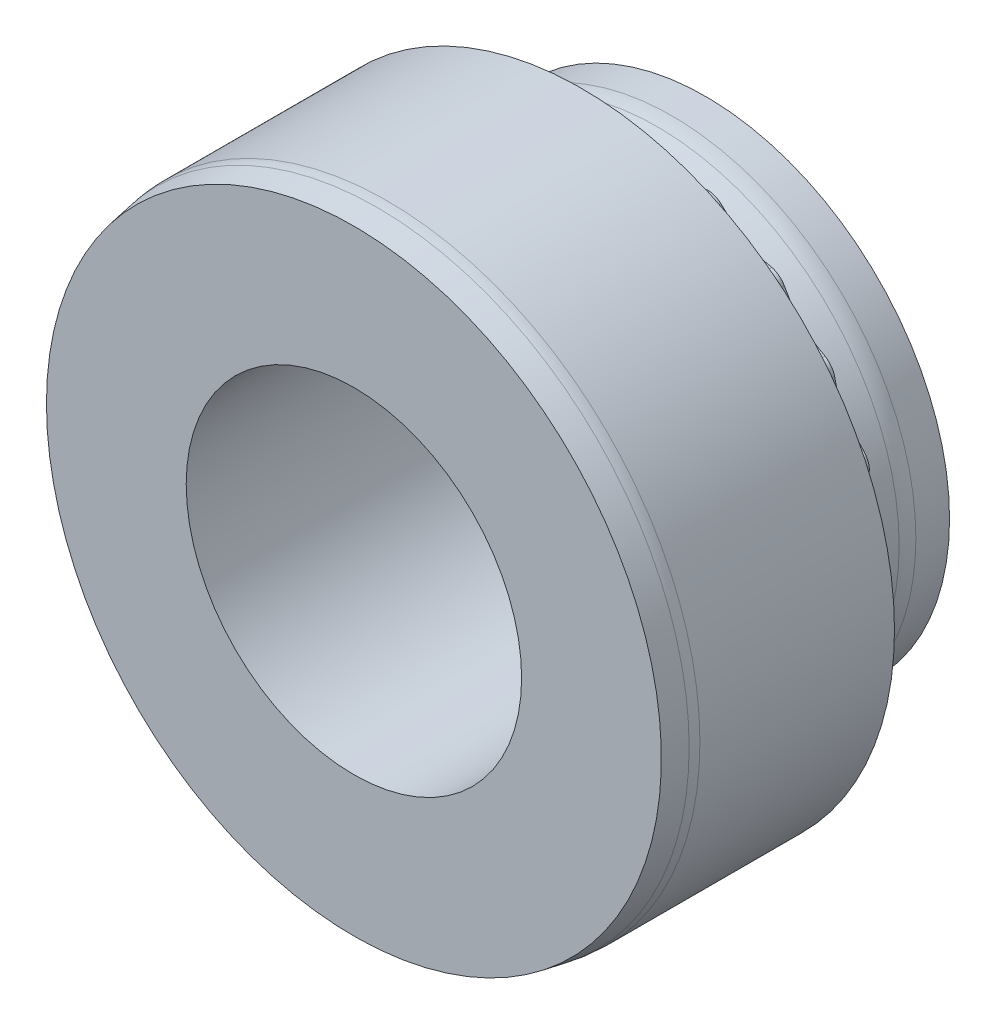
from build123d import *

# Parameters (mm, degrees)
CUT_EXTRUDE2_START       = -0.589333333
CUT_EXTRUDE2_DEPTH       = 0.589333333
FILLET3_R                = 0.2194075
CIRPATTERN1_COUNT        = 24
FILLET3_OF_CIRPATTERN1_R = 0.2194075
FILLET4_R                = 0.2194075
SKETCH12_W               = 6.29
SKETCH12_H               = 3
CHAMFER1_SIZE            = 0.51
CHAMFER1_SIZE2           = 0.08992676
FILLET5_R                = 1.02


with BuildPart() as part:
    # Sketch2 → Revolve1 (revolve)
    with BuildSketch(Plane(origin=(0, 0, 0), x_dir=(0, 0, -1), z_dir=(1, 0, 0)), mode=Mode.PRIVATE) as revolve1_sk:
        Polygon((0, 0), (0, 4.365), (-0.736666667, 4.365), (-1.620666667, 4.128132914), (-1.620666667, 5.17075), (-2.21, 5.17075), (-2.21, 5.59), (-6.29, 5.59), (-6.29, 0), align=None)
    revolve(revolve1_sk.sketch.rotate(Axis((0, 0, 6.29), (0, 0, -1)), 90), axis=Axis((0, 0, 6.29), (0, 0, -1)))

    # Sketch5 → Cut-Extrude2 (cut)
    with BuildSketch(Plane(origin=(0, 0, 1.620666667), x_dir=(-1, 0, 0), z_dir=(0, 0, -1)).offset(CUT_EXTRUDE2_START)):
        with BuildLine():
            Line((-5.119113982, -0.728922218), (-4.653675, 0))
            Line((-4.653675, 0), (-5.119113982, 0.728922218))
            ThreePointArc((-5.119113982, 0.728922218), (-5.17075, 0), (-5.119113982, -0.728922218))
        make_face()
    cut_extrude2 = extrude(amount=CUT_EXTRUDE2_DEPTH, mode=Mode.SUBTRACT)

    # Fillet3
    fillet3_edges = [part.edges().sort_by_distance(p)[0] for p in [
        (4.653675, 0, 1.915333333),
    ]]
    fillet(fillet3_edges, radius=FILLET3_R)

    # CirPattern1: Cut-Extrude2 ×24 about axis
    cirpattern1_axis = Axis((0, 0, 0), (0, 0, 1))
    for i in range(1, CIRPATTERN1_COUNT):
        add(cut_extrude2.rotate(cirpattern1_axis, i * 360 / CIRPATTERN1_COUNT), mode=Mode.SUBTRACT)

    # Fillet3 of CirPattern1
    fillet3_of_cirpattern1_edges = [part.edges().sort_by_distance(p)[0] for p in [
        (4.49510487, 1.20445972, 1.915333333),
        (4.030200771, 2.3268375, 1.915333333),
        (3.29064515, 3.29064515, 1.915333333),
        (2.3268375, 4.030200771, 1.915333333),
        (1.20445972, 4.49510487, 1.915333333),
        (0, 4.653675, 1.915333333),
        (-1.20445972, 4.49510487, 1.915333333),
        (-2.3268375, 4.030200771, 1.915333333),
        (-3.29064515, 3.29064515, 1.915333333),
        (-4.030200771, 2.3268375, 1.915333333),
        (-4.49510487, 1.20445972, 1.915333333),
        (-4.653675, 0, 1.915333333),
        (-4.49510487, -1.20445972, 1.915333333),
        (-4.030200771, -2.3268375, 1.915333333),
        (-3.29064515, -3.29064515, 1.915333333),
        (-2.3268375, -4.030200771, 1.915333333),
        (-1.20445972, -4.49510487, 1.915333333),
        (0, -4.653675, 1.915333333),
        (1.20445972, -4.49510487, 1.915333333),
        (2.3268375, -4.030200771, 1.915333333),
        (3.29064515, -3.29064515, 1.915333333),
        (4.030200771, -2.3268375, 1.915333333),
        (4.49510487, -1.20445972, 1.915333333),
    ]]
    fillet(fillet3_of_cirpattern1_edges, radius=FILLET3_OF_CIRPATTERN1_R)

    # Fillet4
    fillet4_edges = [part.edges().sort_by_distance(p)[0] for p in [
        (5.080786875, 0.668898282, 1.915333333),
        (5.080786875, -0.668898282, 1.915333333),
        (4.734539646, 1.961110533, 1.915333333),
        (4.065641364, 3.119676342, 1.915333333),
        (3.119676342, 4.065641364, 1.915333333),
        (1.961110533, 4.734539646, 1.915333333),
        (0.668898282, 5.080786875, 1.915333333),
        (-0.668898282, 5.080786875, 1.915333333),
        (-1.961110533, 4.734539646, 1.915333333),
        (-3.119676342, 4.065641364, 1.915333333),
        (-4.065641364, 3.119676342, 1.915333333),
        (-4.734539646, 1.961110533, 1.915333333),
        (-5.080786875, 0.668898282, 1.915333333),
        (-5.080786875, -0.668898282, 1.915333333),
        (-4.734539646, -1.961110533, 1.915333333),
        (-4.065641364, -3.119676342, 1.915333333),
        (-3.119676342, -4.065641364, 1.915333333),
        (-1.961110533, -4.734539646, 1.915333333),
        (-0.668898282, -5.080786875, 1.915333333),
        (0.668898282, -5.080786875, 1.915333333),
        (1.961110533, -4.734539646, 1.915333333),
        (3.119676342, -4.065641364, 1.915333333),
        (4.065641364, -3.119676342, 1.915333333),
        (4.734539646, -1.961110533, 1.915333333),
    ]]
    fillet(fillet4_edges, radius=FILLET4_R)

    # Sketch11 → Cut-Revolve3 (revolve, cut)
    with BuildSketch(Plane(origin=(0, 0, 0), x_dir=(1, 0, 0), z_dir=(0, 1, 0))):
        Polygon((4.653675, -1.620666667), (5.17075, -1.808866576), (5.17075, -1.620666667), align=None)
    revolve(axis=Axis((0, 0, 6.29), (0, 0, -1)), mode=Mode.SUBTRACT)

    # Sketch12 → Cut-Revolve4 (revolve, cut)
    with BuildSketch(Plane(origin=(0, 0, 0), x_dir=(0, 0, -1), z_dir=(1, 0, 0)), mode=Mode.PRIVATE) as cut_revolve4_sk:
        with Locations((-3.145, -1.5)):
            Rectangle(SKETCH12_W, SKETCH12_H)
    revolve(cut_revolve4_sk.sketch.rotate(Axis((0, 0, 6.29), (0, 0, -1)), 270), axis=Axis((0, 0, 6.29), (0, 0, -1)), mode=Mode.SUBTRACT)

    # Chamfer1
    chamfer1_edges = [part.edges().sort_by_distance(p)[0] for p in [
        (-5.59, 0, 6.29),
    ]]
    chamfer1_side = [part.faces().sort_by_distance(p)[0] for p in [
        (-5.59, 0, 4.25),
    ]]
    chamfer(chamfer1_edges, length=CHAMFER1_SIZE, length2=CHAMFER1_SIZE2, reference=chamfer1_side[0])

    # Fillet5
    fillet5_edges = [part.edges().sort_by_distance(p)[0] for p in [
        (-5.59, 0, 5.78),
        (-4.365, 0, 0.736666667),
    ]]
    fillet(fillet5_edges, radius=FILLET5_R)


solid = part.part
